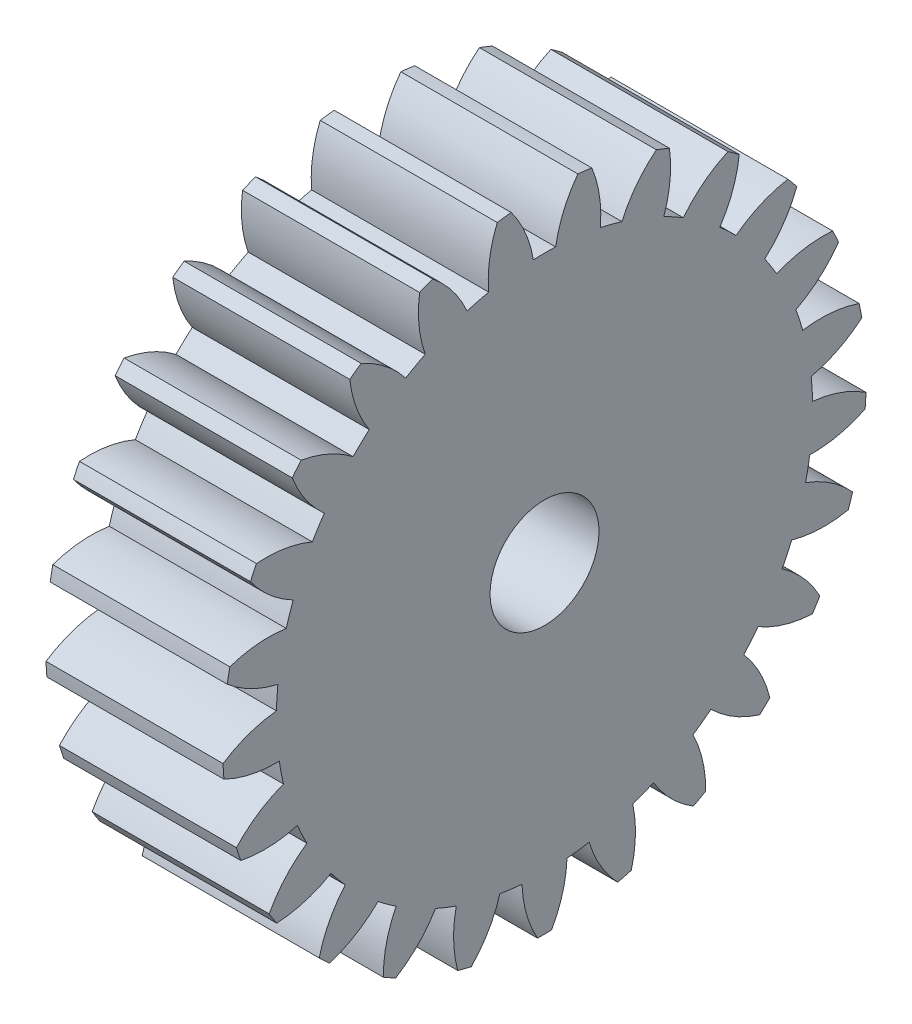
from build123d import *

# Parameters (mm, degrees)
BASPROSKE_W     = 13
BASPROSKE_H     = 23.625
TOOTHCUT_DEPTH  = 36.850819377
TEETHCUTS_COUNT = 25
TEETHCUTS_ANGLE = 345.6
BORSKE_R        = 4
BORE_DEPTH      = 50.0000508


with BuildPart() as part:
    # BasProSke → Base-Revolve (revolve)
    with BuildSketch(Plane(origin=(0, 0, 0), x_dir=(1, 0, 0), z_dir=(0, 1, 0)), mode=Mode.PRIVATE) as base_revolve_sk:
        with Locations((6.5, 11.8125)):
            Rectangle(BASPROSKE_W, BASPROSKE_H)
    revolve(base_revolve_sk.sketch.rotate(Axis((-10, 0, 0), (1, 0, 0)), 180), axis=Axis((-10, 0, 0), (1, 0, 0)))

    # TooCutSke → ToothCut (cut, through all)
    with BuildSketch(Plane(origin=(0, 0, 0), x_dir=(0, 0, -1), z_dir=(1, 0, 0))):
        with BuildLine():
            ThreePointArc((0.818998709, 19.669456611), (0, 19.6865), (-0.818998709, 19.669456611))
            ThreePointArc((-0.818998709, 19.669456611), (-1.409254574, 21.695516899), (-2.467415344, 23.521336732))
            ThreePointArc((-2.467415344, 23.521336732), (0, 23.6504), (2.467415344, 23.521336732))
            ThreePointArc((2.467415344, 23.521336732), (1.409254574, 21.695516899), (0.818998709, 19.669456611))
        make_face()
    toothcut = extrude(amount=TOOTHCUT_DEPTH, mode=Mode.SUBTRACT)

    # TeethCuts: ToothCut ×25 about axis
    teethcuts_axis = Axis((-10, 0, 0), (1, 0, 0))
    for i in range(1, TEETHCUTS_COUNT):
        add(toothcut.rotate(teethcuts_axis, i * TEETHCUTS_ANGLE / (TEETHCUTS_COUNT - 1)), mode=Mode.SUBTRACT)

    # BorSke → Bore (cut, symmetric)
    with BuildSketch(Plane(origin=(0, 0, 0), x_dir=(0, 0, -1), z_dir=(1, 0, 0))):
        with Locations(Location((0, 0, 0), (0, 0, 180))):
            Circle(BORSKE_R)
    extrude(amount=BORE_DEPTH, both=True, mode=Mode.SUBTRACT)


solid = part.part
